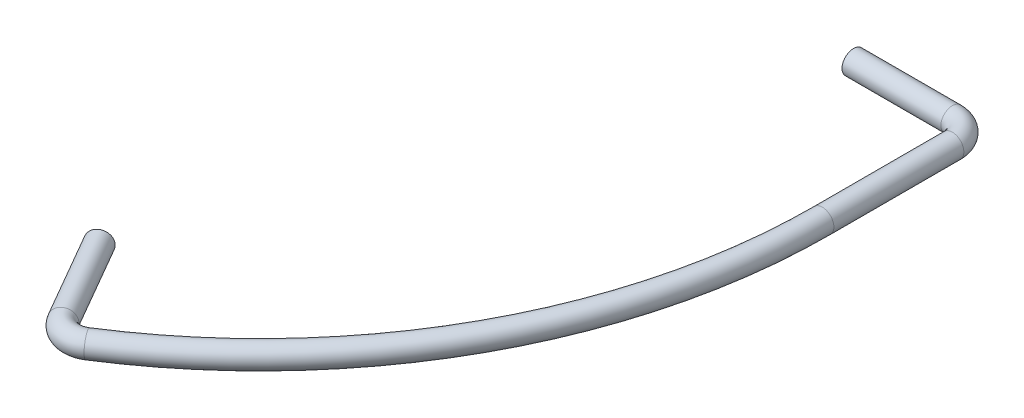
from build123d import *

# Parameters (mm, degrees)
CROSS_SECTION_SKETCH_R = 15


with BuildPart() as part:
    # Bar Sweep: sweep along a path in Overhead Sketch
    with BuildLine(Plane(origin=(0, 0, 0), x_dir=(1, 0, 0), z_dir=(0, 1, 0))) as bar_sweep_path:
        Line((575.638587088, 200), (705, 200))
        ThreePointArc((705, 200), (726.213203436, 191.213203436), (735, 170))
        Line((735, 170), (735, 0))
        ThreePointArc((735, 0), (644.20543415, -353.870539338), (394.253445956, -620.313807965))
        ThreePointArc((394.253445956, -620.313807965), (371.015343762, -624.131330145), (352.180706456, -609.994877028))
        Line((352.180706456, -609.994877028), (287.5, -497.964607176))
    # Cross Section Sketch → Bar Sweep (sweep)
    with BuildSketch(Plane.ZY.offset(-575.638587088)):
        with Locations((-200, 0)):
            Circle(CROSS_SECTION_SKETCH_R)
    sweep(path=bar_sweep_path.line)


solid = part.part
